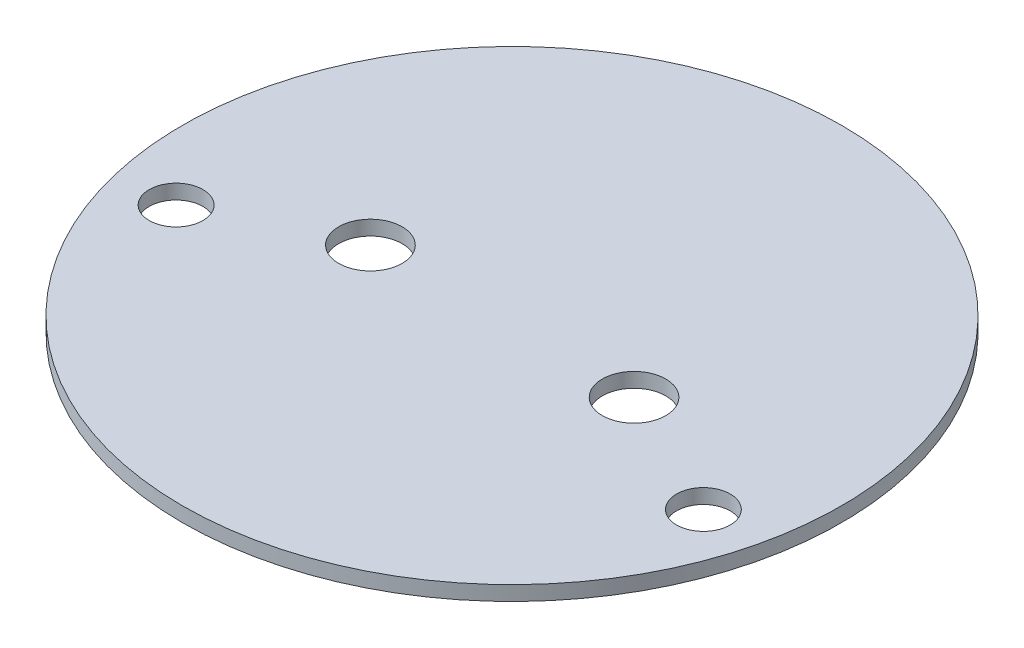
from build123d import *

# Parameters (mm, degrees)
SKETCH1_R           = 33.75
SKETCH1_R_2         = 2.75
SKETCH1_R_3         = 3.25
BOSS_EXTRUDE1_DEPTH = 1.5


with BuildPart() as part:
    # Sketch1 → Boss-Extrude1 (new body)
    with BuildSketch(Plane(origin=(0, 0, 0), x_dir=(1, 0, 0), z_dir=(0, 1, 0))):
        with Locations(Location((0, 0, 0), (0, 0, 270))):
            Circle(SKETCH1_R)
        with Locations(Location((-27, -7.4, 0), (0, 0, 270))):
            Circle(SKETCH1_R_2, mode=Mode.SUBTRACT)
        with Locations(Location((27, -7.4, 0), (0, 0, 270))):
            Circle(SKETCH1_R_2, mode=Mode.SUBTRACT)
        with Locations(Location((-13.5, -1, 0), (0, 0, 270))):
            Circle(SKETCH1_R_3, mode=Mode.SUBTRACT)
        with Locations(Location((13.5, -1, 0), (0, 0, 270))):
            Circle(SKETCH1_R_3, mode=Mode.SUBTRACT)
    extrude(amount=BOSS_EXTRUDE1_DEPTH)


solid = part.part
